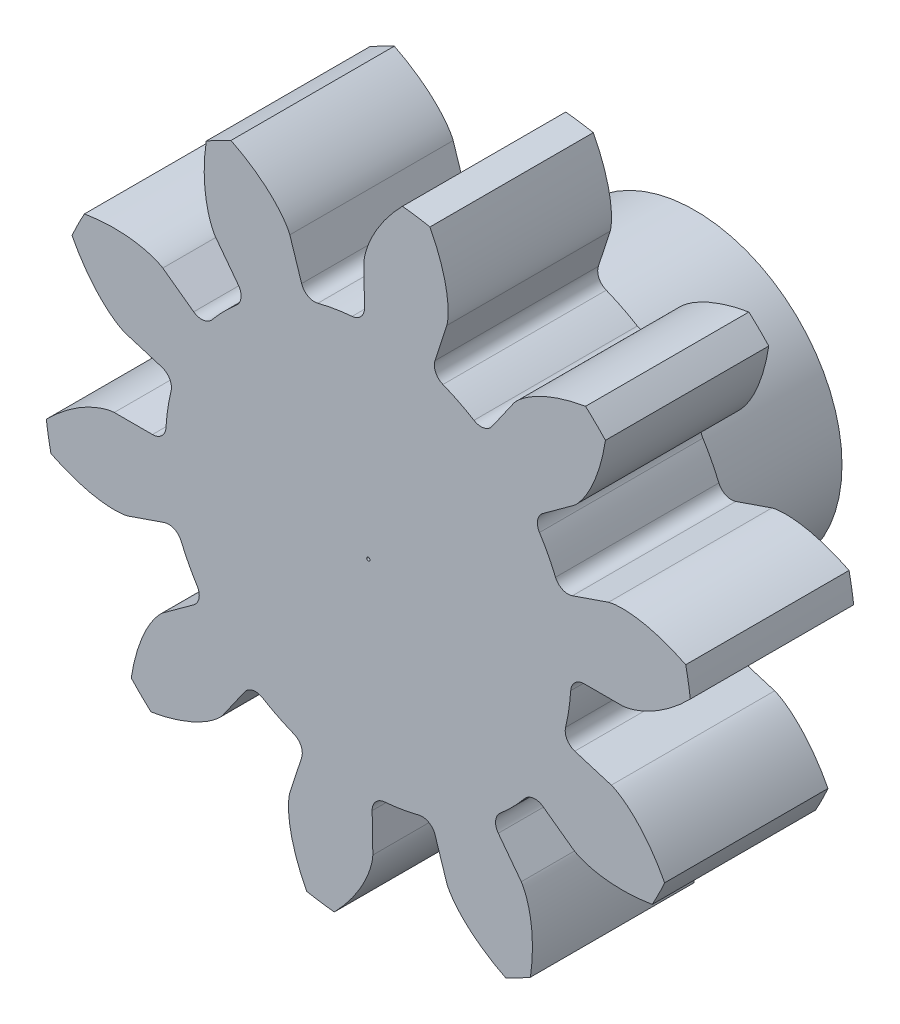
from build123d import *

# Parameters (mm, degrees)
BOSS_EXTRUDE3_DEPTH      = 5
FILLET1_R                = 0.413815057
CIRPATTERN8_COUNT        = 10
CIRPATTERN8_COPY_1_DEPTH = 5
CIRPATTERN8_COPY_2_DEPTH = 5
CIRPATTERN8_COPY_3_DEPTH = 5
CIRPATTERN8_COPY_4_DEPTH = 5
CIRPATTERN8_COPY_5_DEPTH = 5
CIRPATTERN8_COPY_6_DEPTH = 5
CIRPATTERN8_COPY_7_DEPTH = 5
CIRPATTERN8_COPY_8_DEPTH = 5
CIRPATTERN8_COPY_9_DEPTH = 5
FILLET1_OF_CIRPATTERN8_R = 0.413815057
SKETCH3_R                = 0.05
CUT_EXTRUDE2_DEPTH       = 15.822205612
ESQUISSE1_R              = 4.5
BOSS_EXTRU_1_DEPTH       = 5
ESQUISSE2_R              = 3
ENL_V_MAT_EXTRU_1_DEPTH  = 5


with BuildPart() as part:
    # Sketch1 → Boss-Extrude3 (new body)
    with BuildSketch(Plane.XY):
        with BuildLine():
            Line((6.207225848, 0), (7.777179099, 0))
            add(Edge.make_bspline(
                [(7.777179099, 0), (7.782928793, 0.000121674), (7.799042709, 0.000839474), (7.829439553, 0.0036827), (7.87883472, 0.01042556), (7.941390242, 0.022096199), (8.021652117, 0.040693314), (8.115300249, 0.067086133), (8.217090987, 0.100746875), (8.326437515, 0.142334481), (8.434151228, 0.188170675), (8.540192534, 0.237887037), (8.644473201, 0.290982862), (8.769058287, 0.359450689), (8.915951601, 0.447288415), (9.083664713, 0.558116608), (9.268908323, 0.693301192), (9.451920237, 0.840889074), (9.621297555, 0.989013007), (9.743965144, 1.105954518), (9.821090547, 1.182562861), (9.856523807, 1.218543969)],
                knots=[0, 0, 0, 0, 0, 0.005376748, 0.015083688, 0.02853182, 0.046610139, 0.064854849, 0.092110525, 0.119476175, 0.146842495, 0.174208853, 0.201574955, 0.228941013, 0.256307345, 0.307035032, 0.361767351, 0.41649966, 0.471231936, 0.525964281, 0.573449371, 0.573449371, 0.573449371, 0.573449371, 0.573449371], degree=4))
            ThreePointArc((9.856523807, 1.218543969), (9.828093096, 1.429859107), (9.795132507, 1.640515207))
            Line((9.795132507, 1.640515207), (6.121957817, 1.025322005))
            ThreePointArc((6.121957817, 1.025322005), (6.18587211, 0.514430717), (6.207225848, 0))
        make_face()
        with BuildLine():
            ThreePointArc((-6.121957817, -1.025322005), (0.514430717, -6.18587211), (6.207225848, 0))
            ThreePointArc((6.207225848, 0), (6.18587211, 0.514430717), (6.121957817, 1.025322005))
            Line((6.121957817, 1.025322005), (-6.121957817, -1.025322005))
        make_face()
        with BuildLine():
            Line((-6.121957817, -1.025322005), (6.121957817, 1.025322005))
            ThreePointArc((6.121957817, 1.025322005), (-1.025322005, 6.121957817), (-6.121957817, -1.025322005))
        make_face()
    boss_extrude3 = extrude(amount=BOSS_EXTRUDE3_DEPTH)

    # Mirror2: Boss-Extrude3 across plane
    add(boss_extrude3.mirror(Plane(origin=(0, 0, 5), x_dir=(0, 0, 1), z_dir=(0.16518200398392335, -0.9862631015909777, 0))))

    # Fillet1
    fillet1_edges = [part.edges().sort_by_distance(p)[0] for p in [
        (6.207225848, 0, 2.5),
        (5.868496361, 2.022474521, 2.5),
    ]]
    fillet(fillet1_edges, radius=FILLET1_R)

    # CirPattern8: Boss-Extrude3 ×10 about axis
    cirpattern8_axis = Axis((0, 0, 5), (0, 0, -1))
    for i in range(1, CIRPATTERN8_COUNT):
        add(boss_extrude3.rotate(cirpattern8_axis, i * 360 / CIRPATTERN8_COUNT))

    # CirPattern8 copy 1 sketch → CirPattern8 copy 1 (add)
    with BuildSketch(Plane(origin=(0, 0, 0), x_dir=(0.9563844025518575, -0.29211106544519444, 0), z_dir=(0, 0, 1))):
        with BuildLine():
            Line((6.207225848, 0), (7.777179099, 0))
            add(Edge.make_bspline(
                [(7.777179099, 0), (7.782928793, -0.000121674), (7.799042709, -0.000839474), (7.829439553, -0.0036827), (7.87883472, -0.01042556), (7.941390242, -0.022096199), (8.021652117, -0.040693314), (8.115300249, -0.067086133), (8.217090987, -0.100746875), (8.326437515, -0.142334481), (8.434151228, -0.188170675), (8.540192534, -0.237887037), (8.644473201, -0.290982862), (8.769058287, -0.359450689), (8.915951601, -0.447288415), (9.083664713, -0.558116608), (9.268908323, -0.693301192), (9.451920237, -0.840889074), (9.621297555, -0.989013007), (9.743965144, -1.105954518), (9.821090547, -1.182562861), (9.856523807, -1.218543969)],
                knots=[0, 0, 0, 0, 0, 0.005376748, 0.015083688, 0.02853182, 0.046610139, 0.064854849, 0.092110525, 0.119476175, 0.146842495, 0.174208853, 0.201574955, 0.228941013, 0.256307345, 0.307035032, 0.361767351, 0.41649966, 0.471231936, 0.525964281, 0.573449371, 0.573449371, 0.573449371, 0.573449371, 0.573449371], degree=4))
            ThreePointArc((9.856523807, -1.218543969), (9.828093096, -1.429859107), (9.795132507, -1.640515207))
            Line((9.795132507, -1.640515207), (6.121957817, -1.025322005))
            ThreePointArc((6.121957817, -1.025322005), (6.18587211, -0.514430717), (6.207225848, 0))
        make_face()
        with BuildLine():
            ThreePointArc((-6.121957817, 1.025322005), (0.514430717, 6.18587211), (6.207225848, 0))
            ThreePointArc((6.207225848, 0), (6.18587211, -0.514430717), (6.121957817, -1.025322005))
            Line((6.121957817, -1.025322005), (-6.121957817, 1.025322005))
        make_face()
        with BuildLine():
            Line((-6.121957817, 1.025322005), (6.121957817, -1.025322005))
            ThreePointArc((6.121957817, -1.025322005), (-1.025322005, -6.121957817), (-6.121957817, 1.025322005))
        make_face()
    extrude(amount=CIRPATTERN8_COPY_1_DEPTH)

    # CirPattern8 copy 2 sketch → CirPattern8 copy 2 (add)
    with BuildSketch(Plane(origin=(0, 0, 0), x_dir=(0.6020326585194569, -0.7984714635326645, 0), z_dir=(0, 0, 1))):
        with BuildLine():
            Line((6.207225848, 0), (7.777179099, 0))
            add(Edge.make_bspline(
                [(7.777179099, 0), (7.782928793, -0.000121674), (7.799042709, -0.000839474), (7.829439553, -0.0036827), (7.87883472, -0.01042556), (7.941390242, -0.022096199), (8.021652117, -0.040693314), (8.115300249, -0.067086133), (8.217090987, -0.100746875), (8.326437515, -0.142334481), (8.434151228, -0.188170675), (8.540192534, -0.237887037), (8.644473201, -0.290982862), (8.769058287, -0.359450689), (8.915951601, -0.447288415), (9.083664713, -0.558116608), (9.268908323, -0.693301192), (9.451920237, -0.840889074), (9.621297555, -0.989013007), (9.743965144, -1.105954518), (9.821090547, -1.182562861), (9.856523807, -1.218543969)],
                knots=[0, 0, 0, 0, 0, 0.005376748, 0.015083688, 0.02853182, 0.046610139, 0.064854849, 0.092110525, 0.119476175, 0.146842495, 0.174208853, 0.201574955, 0.228941013, 0.256307345, 0.307035032, 0.361767351, 0.41649966, 0.471231936, 0.525964281, 0.573449371, 0.573449371, 0.573449371, 0.573449371, 0.573449371], degree=4))
            ThreePointArc((9.856523807, -1.218543969), (9.828093096, -1.429859107), (9.795132507, -1.640515207))
            Line((9.795132507, -1.640515207), (6.121957817, -1.025322005))
            ThreePointArc((6.121957817, -1.025322005), (6.18587211, -0.514430717), (6.207225848, 0))
        make_face()
        with BuildLine():
            ThreePointArc((-6.121957817, 1.025322005), (0.514430717, 6.18587211), (6.207225848, 0))
            ThreePointArc((6.207225848, 0), (6.18587211, -0.514430717), (6.121957817, -1.025322005))
            Line((6.121957817, -1.025322005), (-6.121957817, 1.025322005))
        make_face()
        with BuildLine():
            Line((-6.121957817, 1.025322005), (6.121957817, -1.025322005))
            ThreePointArc((6.121957817, -1.025322005), (-1.025322005, -6.121957817), (-6.121957817, 1.025322005))
        make_face()
    extrude(amount=CIRPATTERN8_COPY_2_DEPTH)

    # CirPattern8 copy 3 sketch → CirPattern8 copy 3 (add)
    with BuildSketch(Plane(origin=(0, 0, 0), x_dir=(0.01772490127008275, -0.9998429015975289, 0), z_dir=(0, 0, 1))):
        with BuildLine():
            Line((6.207225848, 0), (7.777179099, 0))
            add(Edge.make_bspline(
                [(7.777179099, 0), (7.782928793, -0.000121674), (7.799042709, -0.000839474), (7.829439553, -0.0036827), (7.87883472, -0.01042556), (7.941390242, -0.022096199), (8.021652117, -0.040693314), (8.115300249, -0.067086133), (8.217090987, -0.100746875), (8.326437515, -0.142334481), (8.434151228, -0.188170675), (8.540192534, -0.237887037), (8.644473201, -0.290982862), (8.769058287, -0.359450689), (8.915951601, -0.447288415), (9.083664713, -0.558116608), (9.268908323, -0.693301192), (9.451920237, -0.840889074), (9.621297555, -0.989013007), (9.743965144, -1.105954518), (9.821090547, -1.182562861), (9.856523807, -1.218543969)],
                knots=[0, 0, 0, 0, 0, 0.005376748, 0.015083688, 0.02853182, 0.046610139, 0.064854849, 0.092110525, 0.119476175, 0.146842495, 0.174208853, 0.201574955, 0.228941013, 0.256307345, 0.307035032, 0.361767351, 0.41649966, 0.471231936, 0.525964281, 0.573449371, 0.573449371, 0.573449371, 0.573449371, 0.573449371], degree=4))
            ThreePointArc((9.856523807, -1.218543969), (9.828093096, -1.429859107), (9.795132507, -1.640515207))
            Line((9.795132507, -1.640515207), (6.121957817, -1.025322005))
            ThreePointArc((6.121957817, -1.025322005), (6.18587211, -0.514430717), (6.207225848, 0))
        make_face()
        with BuildLine():
            ThreePointArc((-6.121957817, 1.025322005), (0.514430717, 6.18587211), (6.207225848, 0))
            ThreePointArc((6.207225848, 0), (6.18587211, -0.514430717), (6.121957817, -1.025322005))
            Line((6.121957817, -1.025322005), (-6.121957817, 1.025322005))
        make_face()
        with BuildLine():
            Line((-6.121957817, 1.025322005), (6.121957817, -1.025322005))
            ThreePointArc((6.121957817, -1.025322005), (-1.025322005, -6.121957817), (-6.121957817, 1.025322005))
        make_face()
    extrude(amount=CIRPATTERN8_COPY_3_DEPTH)

    # CirPattern8 copy 4 sketch → CirPattern8 copy 4 (add)
    with BuildSketch(Plane(origin=(0, 0, 0), x_dir=(-0.5733531658172268, -0.8193083346624539, 0), z_dir=(0, 0, 1))):
        with BuildLine():
            Line((6.207225848, 0), (7.777179099, 0))
            add(Edge.make_bspline(
                [(7.777179099, 0), (7.782928793, -0.000121674), (7.799042709, -0.000839474), (7.829439553, -0.0036827), (7.87883472, -0.01042556), (7.941390242, -0.022096199), (8.021652117, -0.040693314), (8.115300249, -0.067086133), (8.217090987, -0.100746875), (8.326437515, -0.142334481), (8.434151228, -0.188170675), (8.540192534, -0.237887037), (8.644473201, -0.290982862), (8.769058287, -0.359450689), (8.915951601, -0.447288415), (9.083664713, -0.558116608), (9.268908323, -0.693301192), (9.451920237, -0.840889074), (9.621297555, -0.989013007), (9.743965144, -1.105954518), (9.821090547, -1.182562861), (9.856523807, -1.218543969)],
                knots=[0, 0, 0, 0, 0, 0.005376748, 0.015083688, 0.02853182, 0.046610139, 0.064854849, 0.092110525, 0.119476175, 0.146842495, 0.174208853, 0.201574955, 0.228941013, 0.256307345, 0.307035032, 0.361767351, 0.41649966, 0.471231936, 0.525964281, 0.573449371, 0.573449371, 0.573449371, 0.573449371, 0.573449371], degree=4))
            ThreePointArc((9.856523807, -1.218543969), (9.828093096, -1.429859107), (9.795132507, -1.640515207))
            Line((9.795132507, -1.640515207), (6.121957817, -1.025322005))
            ThreePointArc((6.121957817, -1.025322005), (6.18587211, -0.514430717), (6.207225848, 0))
        make_face()
        with BuildLine():
            ThreePointArc((-6.121957817, 1.025322005), (0.514430717, 6.18587211), (6.207225848, 0))
            ThreePointArc((6.207225848, 0), (6.18587211, -0.514430717), (6.121957817, -1.025322005))
            Line((6.121957817, -1.025322005), (-6.121957817, 1.025322005))
        make_face()
        with BuildLine():
            Line((-6.121957817, 1.025322005), (6.121957817, -1.025322005))
            ThreePointArc((6.121957817, -1.025322005), (-1.025322005, -6.121957817), (-6.121957817, 1.025322005))
        make_face()
    extrude(amount=CIRPATTERN8_COPY_4_DEPTH)

    # CirPattern8 copy 5 sketch → CirPattern8 copy 5 (add)
    with BuildSketch(Plane(origin=(0, 0, 0), x_dir=(-0.9454298111197103, -0.3258258311523951, 0), z_dir=(0, 0, 1))):
        with BuildLine():
            Line((6.207225848, 0), (7.777179099, 0))
            add(Edge.make_bspline(
                [(7.777179099, 0), (7.782928793, -0.000121674), (7.799042709, -0.000839474), (7.829439553, -0.0036827), (7.87883472, -0.01042556), (7.941390242, -0.022096199), (8.021652117, -0.040693314), (8.115300249, -0.067086133), (8.217090987, -0.100746875), (8.326437515, -0.142334481), (8.434151228, -0.188170675), (8.540192534, -0.237887037), (8.644473201, -0.290982862), (8.769058287, -0.359450689), (8.915951601, -0.447288415), (9.083664713, -0.558116608), (9.268908323, -0.693301192), (9.451920237, -0.840889074), (9.621297555, -0.989013007), (9.743965144, -1.105954518), (9.821090547, -1.182562861), (9.856523807, -1.218543969)],
                knots=[0, 0, 0, 0, 0, 0.005376748, 0.015083688, 0.02853182, 0.046610139, 0.064854849, 0.092110525, 0.119476175, 0.146842495, 0.174208853, 0.201574955, 0.228941013, 0.256307345, 0.307035032, 0.361767351, 0.41649966, 0.471231936, 0.525964281, 0.573449371, 0.573449371, 0.573449371, 0.573449371, 0.573449371], degree=4))
            ThreePointArc((9.856523807, -1.218543969), (9.828093096, -1.429859107), (9.795132507, -1.640515207))
            Line((9.795132507, -1.640515207), (6.121957817, -1.025322005))
            ThreePointArc((6.121957817, -1.025322005), (6.18587211, -0.514430717), (6.207225848, 0))
        make_face()
        with BuildLine():
            ThreePointArc((-6.121957817, 1.025322005), (0.514430717, 6.18587211), (6.207225848, 0))
            ThreePointArc((6.207225848, 0), (6.18587211, -0.514430717), (6.121957817, -1.025322005))
            Line((6.121957817, -1.025322005), (-6.121957817, 1.025322005))
        make_face()
        with BuildLine():
            Line((-6.121957817, 1.025322005), (6.121957817, -1.025322005))
            ThreePointArc((6.121957817, -1.025322005), (-1.025322005, -6.121957817), (-6.121957817, 1.025322005))
        make_face()
    extrude(amount=CIRPATTERN8_COPY_5_DEPTH)

    # CirPattern8 copy 6 sketch → CirPattern8 copy 6 (add)
    with BuildSketch(Plane(origin=(0, 0, 0), x_dir=(-0.9563844025518576, 0.2921110654451943, 0), z_dir=(0, 0, 1))):
        with BuildLine():
            Line((6.207225848, 0), (7.777179099, 0))
            add(Edge.make_bspline(
                [(7.777179099, 0), (7.782928793, -0.000121674), (7.799042709, -0.000839474), (7.829439553, -0.0036827), (7.87883472, -0.01042556), (7.941390242, -0.022096199), (8.021652117, -0.040693314), (8.115300249, -0.067086133), (8.217090987, -0.100746875), (8.326437515, -0.142334481), (8.434151228, -0.188170675), (8.540192534, -0.237887037), (8.644473201, -0.290982862), (8.769058287, -0.359450689), (8.915951601, -0.447288415), (9.083664713, -0.558116608), (9.268908323, -0.693301192), (9.451920237, -0.840889074), (9.621297555, -0.989013007), (9.743965144, -1.105954518), (9.821090547, -1.182562861), (9.856523807, -1.218543969)],
                knots=[0, 0, 0, 0, 0, 0.005376748, 0.015083688, 0.02853182, 0.046610139, 0.064854849, 0.092110525, 0.119476175, 0.146842495, 0.174208853, 0.201574955, 0.228941013, 0.256307345, 0.307035032, 0.361767351, 0.41649966, 0.471231936, 0.525964281, 0.573449371, 0.573449371, 0.573449371, 0.573449371, 0.573449371], degree=4))
            ThreePointArc((9.856523807, -1.218543969), (9.828093096, -1.429859107), (9.795132507, -1.640515207))
            Line((9.795132507, -1.640515207), (6.121957817, -1.025322005))
            ThreePointArc((6.121957817, -1.025322005), (6.18587211, -0.514430717), (6.207225848, 0))
        make_face()
        with BuildLine():
            ThreePointArc((-6.121957817, 1.025322005), (0.514430717, 6.18587211), (6.207225848, 0))
            ThreePointArc((6.207225848, 0), (6.18587211, -0.514430717), (6.121957817, -1.025322005))
            Line((6.121957817, -1.025322005), (-6.121957817, 1.025322005))
        make_face()
        with BuildLine():
            Line((-6.121957817, 1.025322005), (6.121957817, -1.025322005))
            ThreePointArc((6.121957817, -1.025322005), (-1.025322005, -6.121957817), (-6.121957817, 1.025322005))
        make_face()
    extrude(amount=CIRPATTERN8_COPY_6_DEPTH)

    # CirPattern8 copy 7 sketch → CirPattern8 copy 7 (add)
    with BuildSketch(Plane(origin=(0, 0, 0), x_dir=(-0.6020326585194569, 0.7984714635326644, 0), z_dir=(0, 0, 1))):
        with BuildLine():
            Line((6.207225848, 0), (7.777179099, 0))
            add(Edge.make_bspline(
                [(7.777179099, 0), (7.782928793, -0.000121674), (7.799042709, -0.000839474), (7.829439553, -0.0036827), (7.87883472, -0.01042556), (7.941390242, -0.022096199), (8.021652117, -0.040693314), (8.115300249, -0.067086133), (8.217090987, -0.100746875), (8.326437515, -0.142334481), (8.434151228, -0.188170675), (8.540192534, -0.237887037), (8.644473201, -0.290982862), (8.769058287, -0.359450689), (8.915951601, -0.447288415), (9.083664713, -0.558116608), (9.268908323, -0.693301192), (9.451920237, -0.840889074), (9.621297555, -0.989013007), (9.743965144, -1.105954518), (9.821090547, -1.182562861), (9.856523807, -1.218543969)],
                knots=[0, 0, 0, 0, 0, 0.005376748, 0.015083688, 0.02853182, 0.046610139, 0.064854849, 0.092110525, 0.119476175, 0.146842495, 0.174208853, 0.201574955, 0.228941013, 0.256307345, 0.307035032, 0.361767351, 0.41649966, 0.471231936, 0.525964281, 0.573449371, 0.573449371, 0.573449371, 0.573449371, 0.573449371], degree=4))
            ThreePointArc((9.856523807, -1.218543969), (9.828093096, -1.429859107), (9.795132507, -1.640515207))
            Line((9.795132507, -1.640515207), (6.121957817, -1.025322005))
            ThreePointArc((6.121957817, -1.025322005), (6.18587211, -0.514430717), (6.207225848, 0))
        make_face()
        with BuildLine():
            ThreePointArc((-6.121957817, 1.025322005), (0.514430717, 6.18587211), (6.207225848, 0))
            ThreePointArc((6.207225848, 0), (6.18587211, -0.514430717), (6.121957817, -1.025322005))
            Line((6.121957817, -1.025322005), (-6.121957817, 1.025322005))
        make_face()
        with BuildLine():
            Line((-6.121957817, 1.025322005), (6.121957817, -1.025322005))
            ThreePointArc((6.121957817, -1.025322005), (-1.025322005, -6.121957817), (-6.121957817, 1.025322005))
        make_face()
    extrude(amount=CIRPATTERN8_COPY_7_DEPTH)

    # CirPattern8 copy 8 sketch → CirPattern8 copy 8 (add)
    with BuildSketch(Plane(origin=(0, 0, 0), x_dir=(-0.017724901270082805, 0.9998429015975289, 0), z_dir=(0, 0, 1))):
        with BuildLine():
            Line((6.207225848, 0), (7.777179099, 0))
            add(Edge.make_bspline(
                [(7.777179099, 0), (7.782928793, -0.000121674), (7.799042709, -0.000839474), (7.829439553, -0.0036827), (7.87883472, -0.01042556), (7.941390242, -0.022096199), (8.021652117, -0.040693314), (8.115300249, -0.067086133), (8.217090987, -0.100746875), (8.326437515, -0.142334481), (8.434151228, -0.188170675), (8.540192534, -0.237887037), (8.644473201, -0.290982862), (8.769058287, -0.359450689), (8.915951601, -0.447288415), (9.083664713, -0.558116608), (9.268908323, -0.693301192), (9.451920237, -0.840889074), (9.621297555, -0.989013007), (9.743965144, -1.105954518), (9.821090547, -1.182562861), (9.856523807, -1.218543969)],
                knots=[0, 0, 0, 0, 0, 0.005376748, 0.015083688, 0.02853182, 0.046610139, 0.064854849, 0.092110525, 0.119476175, 0.146842495, 0.174208853, 0.201574955, 0.228941013, 0.256307345, 0.307035032, 0.361767351, 0.41649966, 0.471231936, 0.525964281, 0.573449371, 0.573449371, 0.573449371, 0.573449371, 0.573449371], degree=4))
            ThreePointArc((9.856523807, -1.218543969), (9.828093096, -1.429859107), (9.795132507, -1.640515207))
            Line((9.795132507, -1.640515207), (6.121957817, -1.025322005))
            ThreePointArc((6.121957817, -1.025322005), (6.18587211, -0.514430717), (6.207225848, 0))
        make_face()
        with BuildLine():
            ThreePointArc((-6.121957817, 1.025322005), (0.514430717, 6.18587211), (6.207225848, 0))
            ThreePointArc((6.207225848, 0), (6.18587211, -0.514430717), (6.121957817, -1.025322005))
            Line((6.121957817, -1.025322005), (-6.121957817, 1.025322005))
        make_face()
        with BuildLine():
            Line((-6.121957817, 1.025322005), (6.121957817, -1.025322005))
            ThreePointArc((6.121957817, -1.025322005), (-1.025322005, -6.121957817), (-6.121957817, 1.025322005))
        make_face()
    extrude(amount=CIRPATTERN8_COPY_8_DEPTH)

    # CirPattern8 copy 9 sketch → CirPattern8 copy 9 (add)
    with BuildSketch(Plane(origin=(0, 0, 0), x_dir=(0.5733531658172268, 0.8193083346624541, 0), z_dir=(0, 0, 1))):
        with BuildLine():
            Line((6.207225848, 0), (7.777179099, 0))
            add(Edge.make_bspline(
                [(7.777179099, 0), (7.782928793, -0.000121674), (7.799042709, -0.000839474), (7.829439553, -0.0036827), (7.87883472, -0.01042556), (7.941390242, -0.022096199), (8.021652117, -0.040693314), (8.115300249, -0.067086133), (8.217090987, -0.100746875), (8.326437515, -0.142334481), (8.434151228, -0.188170675), (8.540192534, -0.237887037), (8.644473201, -0.290982862), (8.769058287, -0.359450689), (8.915951601, -0.447288415), (9.083664713, -0.558116608), (9.268908323, -0.693301192), (9.451920237, -0.840889074), (9.621297555, -0.989013007), (9.743965144, -1.105954518), (9.821090547, -1.182562861), (9.856523807, -1.218543969)],
                knots=[0, 0, 0, 0, 0, 0.005376748, 0.015083688, 0.02853182, 0.046610139, 0.064854849, 0.092110525, 0.119476175, 0.146842495, 0.174208853, 0.201574955, 0.228941013, 0.256307345, 0.307035032, 0.361767351, 0.41649966, 0.471231936, 0.525964281, 0.573449371, 0.573449371, 0.573449371, 0.573449371, 0.573449371], degree=4))
            ThreePointArc((9.856523807, -1.218543969), (9.828093096, -1.429859107), (9.795132507, -1.640515207))
            Line((9.795132507, -1.640515207), (6.121957817, -1.025322005))
            ThreePointArc((6.121957817, -1.025322005), (6.18587211, -0.514430717), (6.207225848, 0))
        make_face()
        with BuildLine():
            ThreePointArc((-6.121957817, 1.025322005), (0.514430717, 6.18587211), (6.207225848, 0))
            ThreePointArc((6.207225848, 0), (6.18587211, -0.514430717), (6.121957817, -1.025322005))
            Line((6.121957817, -1.025322005), (-6.121957817, 1.025322005))
        make_face()
        with BuildLine():
            Line((-6.121957817, 1.025322005), (6.121957817, -1.025322005))
            ThreePointArc((6.121957817, -1.025322005), (-1.025322005, -6.121957817), (-6.121957817, 1.025322005))
        make_face()
    extrude(amount=CIRPATTERN8_COPY_9_DEPTH)

    # Fillet1 of CirPattern8
    fillet1_of_cirpattern8_edges = [part.edges().sort_by_distance(p)[0] for p in [
        (5.021751199, -3.648515811, 2.5),
        (5.936493984, -1.813199356, 2.5),
        (1.918138275, -5.90342259, 2.5),
        (3.736952679, -4.956292707, 2.5),
        (-1.918138275, -5.90342259, 2.5),
        (0.110022465, -6.206250702, 2.5),
        (-5.021751199, -3.648515811, 2.5),
        (-3.558932591, -5.085631872, 2.5),
        (-6.207225848, 0, 2.5),
        (-5.868496361, -2.022474521, 2.5),
        (-5.021751199, 3.648515811, 2.5),
        (-5.936493984, 1.813199356, 2.5),
        (-1.918138275, 5.90342259, 2.5),
        (-3.736952679, 4.956292707, 2.5),
        (1.918138275, 5.90342259, 2.5),
        (-0.110022465, 6.206250702, 2.5),
        (5.021751199, 3.648515811, 2.5),
        (3.558932591, 5.085631872, 2.5),
    ]]
    fillet(fillet1_of_cirpattern8_edges, radius=FILLET1_OF_CIRPATTERN8_R)

    # Sketch3 → Cut-Extrude2 (cut, through all)
    with BuildSketch(Plane.XY.offset(5)):
        Circle(SKETCH3_R)
    extrude(amount=-CUT_EXTRUDE2_DEPTH, mode=Mode.SUBTRACT)

    # Esquisse1 → Boss.-Extru.1 (add)
    with BuildSketch(Plane(origin=(0, 0, 0), x_dir=(-1, 0, 0), z_dir=(0, 0, -1))):
        with Locations(Location((0, -0.25231388, 0), (0, 0, 180))):
            Circle(ESQUISSE1_R)
    extrude(amount=BOSS_EXTRU_1_DEPTH)

    # Esquisse2 → Enlèv. mat.-Extru.1 (cut)
    with BuildSketch(Plane(origin=(0, 0, -5), x_dir=(-1, 0, 0), z_dir=(0, 0, -1))):
        Circle(ESQUISSE2_R)
    extrude(amount=-ENL_V_MAT_EXTRU_1_DEPTH, mode=Mode.SUBTRACT)


solid = part.part
